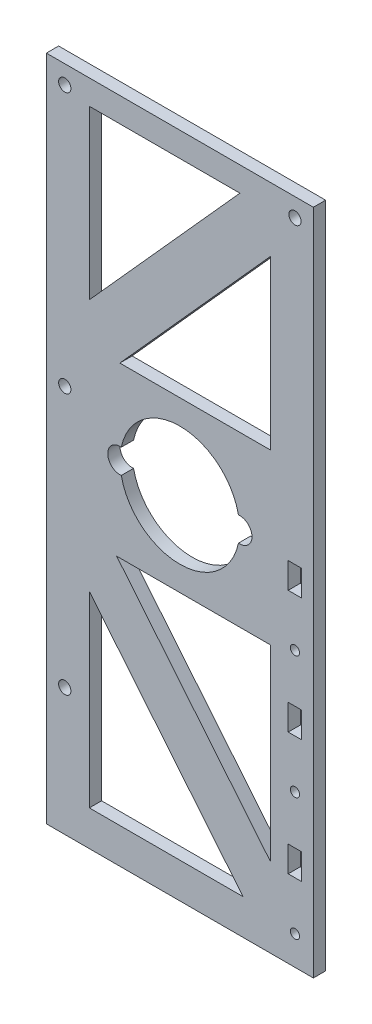
from build123d import *

# Parameters (mm, degrees)
EXTRUDE_1_DEPTH     = 4
SKETCH_2_R          = 1.5
SKETCH_2_R_2        = 2
SKETCH_2_W          = 4.4
SKETCH_2_H          = 8.4
CUT_EXTRUDE_1_DEPTH = 4
SKETCH_3_W          = 87
SKETCH_3_H          = 3.5
EXTRUDE_2_DEPTH     = 4


with BuildPart() as part:
    # 草图1 → 凸台-拉伸1 (new body)
    with BuildSketch(Plane.XY):
        Polygon((37.5, 50), (-37.5, 50), (-43.5, 50), (-43.5, -57), (-43.5, -164), (-37.5, -164), (37.5, -164), (43.5, -164), (43.5, -57), (43.5, 50), align=None)
        Polygon((-29.5, -156), (-29.5, -94.879730583), (20.598581489, -156), align=None, mode=Mode.SUBTRACT)
        Polygon((-20.598581489, -80.5), (29.5, -80.5), (29.5, -141.620269417), align=None, mode=Mode.SUBTRACT)
        with BuildLine():
            ThreePointArc((-19.08974359, -49.021094412), (0, -33.5), (19.08974359, -49.021094412))
            ThreePointArc((19.08974359, -49.021094412), (23.5, -53), (19.08974359, -56.978905588))
            ThreePointArc((19.08974359, -56.978905588), (0, -72.5), (-19.08974359, -56.978905588))
            ThreePointArc((-19.08974359, -56.978905588), (-23.5, -53), (-19.08974359, -49.021094412))
        make_face(mode=Mode.SUBTRACT)
        Polygon((-29.5, 42), (19.561080579, 42), (-29.5, -12.621336377), align=None, mode=Mode.SUBTRACT)
        Polygon((-19.561080579, -25.5), (29.5, 29.121336377), (29.5, -25.5), align=None, mode=Mode.SUBTRACT)
    extrude(amount=EXTRUDE_1_DEPTH)

    # 草图2 → 切除-拉伸1 (cut)
    with BuildSketch(Plane.XY.offset(4)):
        with Locations((37.5, -158)):
            Circle(SKETCH_2_R)
        with Locations((37.5, -78)):
            Circle(SKETCH_2_R)
        with Locations((37.5, -118)):
            Circle(SKETCH_2_R)
        with Locations((37.5, 44)):
            Circle(SKETCH_2_R_2)
        with Locations((-37.5, 44)):
            Circle(SKETCH_2_R_2)
        with Locations((-37.5, -41)):
            Circle(SKETCH_2_R_2)
        with Locations((-37.5, -126)):
            Circle(SKETCH_2_R_2)
        with Locations((37.5, -138)):
            Rectangle(SKETCH_2_W, SKETCH_2_H)
        with Locations((37.5, -98)):
            Rectangle(SKETCH_2_W, SKETCH_2_H)
        with Locations((37.5, -58)):
            Rectangle(SKETCH_2_W, SKETCH_2_H)
    extrude(amount=-CUT_EXTRUDE_1_DEPTH, mode=Mode.SUBTRACT)

    # 草图3 → 凸台-拉伸2 (add)
    with BuildSketch(Plane.XY.offset(4)):
        with Locations((0, -165.75)):
            Rectangle(SKETCH_3_W, SKETCH_3_H)
    extrude(amount=-EXTRUDE_2_DEPTH)


solid = part.part
